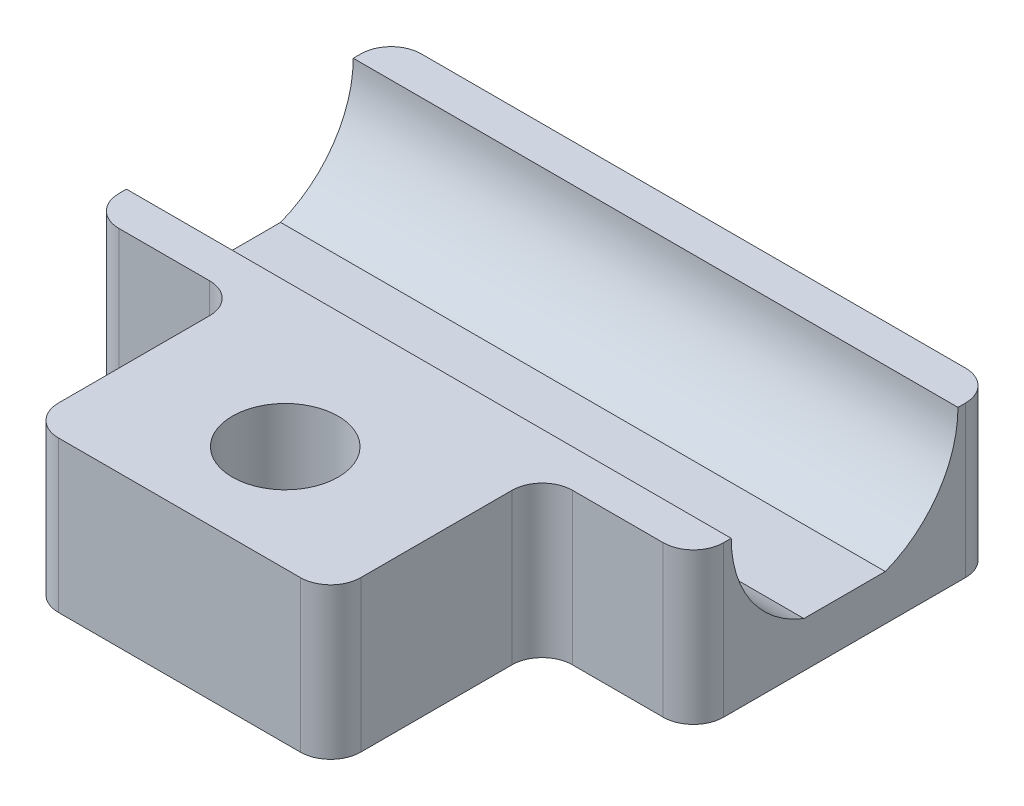
from build123d import *

# Parameters (mm, degrees)
BOSS_EXTRUDE1_DEPTH = 10
SKETCH2_R           = 3.5
CUT_EXTRUDE1_DEPTH  = 10
CUT_EXTRUDE2_DEPTH  = 48.707441768
FILLET1_R           = 2


with BuildPart() as part:
    # Sketch1 → Boss-Extrude1 (new body)
    with BuildSketch(Plane(origin=(0, 0, 0), x_dir=(1, 0, 0), z_dir=(0, 1, 0))):
        Polygon((-10, -10), (-20, -10), (-20, 10), (20, 10), (20, -10), (10, -10), (10, -24), (-10, -24), align=None)
    extrude(amount=BOSS_EXTRUDE1_DEPTH)

    # Sketch2 → Cut-Extrude1 (cut)
    with BuildSketch(Plane(origin=(0, 10, 0), x_dir=(1, 0, 0), z_dir=(0, 1, 0))):
        with Locations(Location((0, -17, 0), (0, 0, 270))):
            Circle(SKETCH2_R)
    extrude(amount=-CUT_EXTRUDE1_DEPTH, mode=Mode.SUBTRACT)

    # Sketch3 → Cut-Extrude2 (cut, through all)
    with BuildSketch(Plane(origin=(20, 0, 0), x_dir=(0, 0, -1), z_dir=(1, 0, 0))):
        with BuildLine():
            Line((-2.692582404, 3), (2.692582404, 3))
            ThreePointArc((2.692582404, 3), (0, 17.5), (-2.692582404, 3))
        make_face()
    extrude(amount=-CUT_EXTRUDE2_DEPTH, mode=Mode.SUBTRACT)

    # Fillet1
    fillet1_edges = [part.edges().sort_by_distance(p)[0] for p in [
        (-20, 5, -10),
        (20, 5, -10),
        (20, 5, 10),
        (10, 5, 10),
        (10, 5, 24),
        (-10, 5, 24),
        (-10, 5, 10),
        (-20, 5, 10),
    ]]
    fillet(fillet1_edges, radius=FILLET1_R)


solid = part.part
